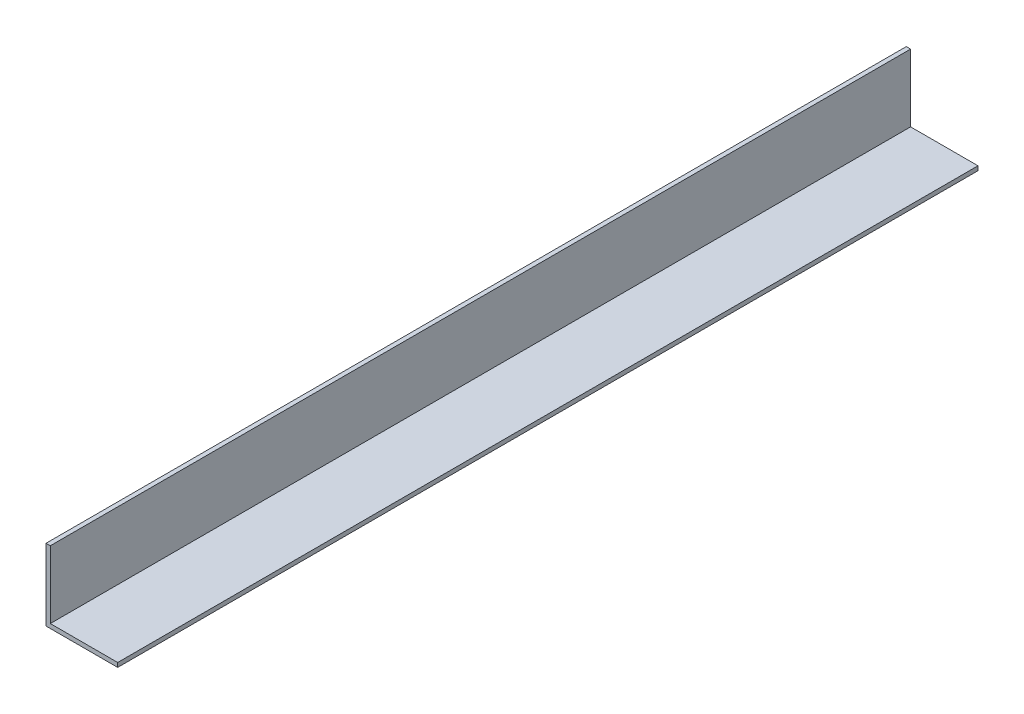
from build123d import *

# Parameters (mm, degrees)
BOSS_EXTRUDE1_DEPTH = 300


with BuildPart() as part:
    # Sketch1 → Boss-Extrude1 (new body)
    with BuildSketch(Plane.XY):
        Polygon((0, 0), (0, 25), (1.5, 25), (1.5, 1.5), (25, 1.5), (25, 0), align=None)
    extrude(amount=BOSS_EXTRUDE1_DEPTH)


solid = part.part
